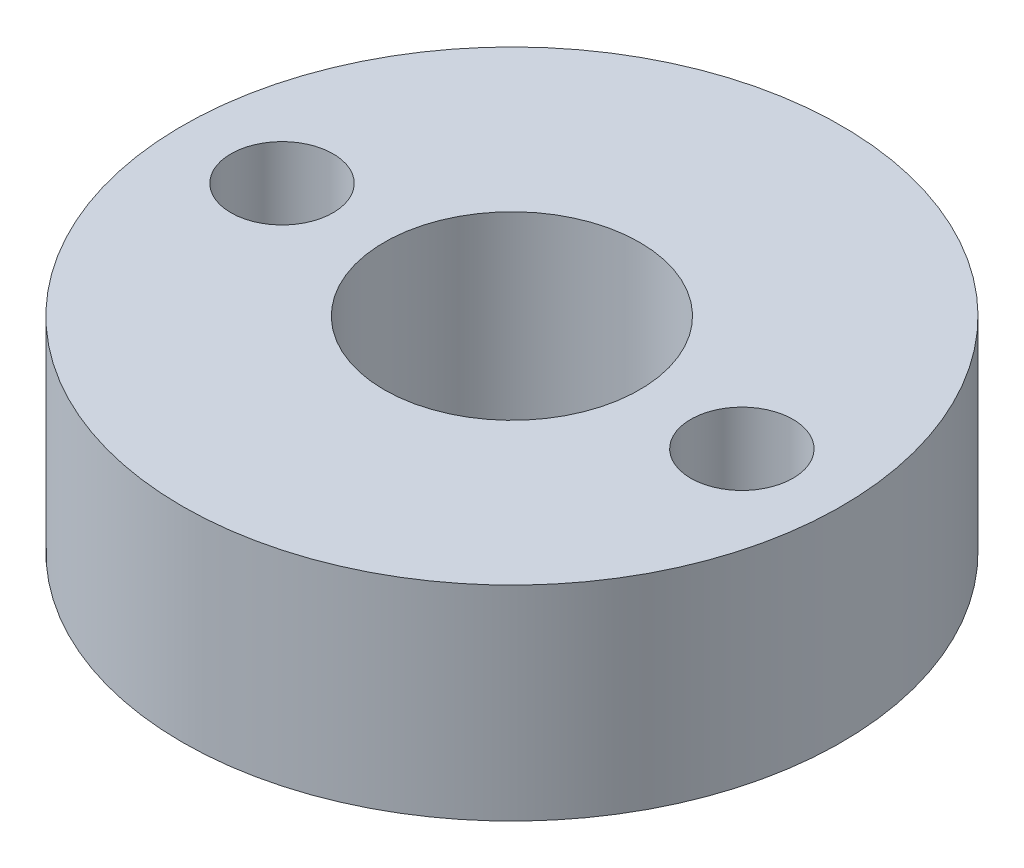
from build123d import *

# Parameters (mm, degrees)
SKETCH1_R           = 6.45
BOSS_EXTRUDE1_DEPTH = 4
SKETCH2_R           = 2.5
SKETCH2_R_2         = 1
CUT_EXTRUDE1_DEPTH  = 4


with BuildPart() as part:
    # Sketch1 → Boss-Extrude1 (new body)
    with BuildSketch(Plane(origin=(0, 0, 0), x_dir=(1, 0, 0), z_dir=(0, 1, 0))):
        with Locations(Location((0, 0, 0), (0, 0, 270))):
            Circle(SKETCH1_R)
    extrude(amount=BOSS_EXTRUDE1_DEPTH)

    # Sketch2 → Cut-Extrude1 (cut)
    with BuildSketch(Plane(origin=(0, 4, 0), x_dir=(1, 0, 0), z_dir=(0, 1, 0))):
        with Locations(Location((0, 0, 0), (0, 0, 270))):
            Circle(SKETCH2_R)
        with Locations(Location((4.5, 0, 0), (0, 0, 270))):
            Circle(SKETCH2_R_2)
        with Locations(Location((-4.5, 0, 0), (0, 0, 270))):
            Circle(SKETCH2_R_2)
    extrude(amount=-CUT_EXTRUDE1_DEPTH, mode=Mode.SUBTRACT)


solid = part.part
